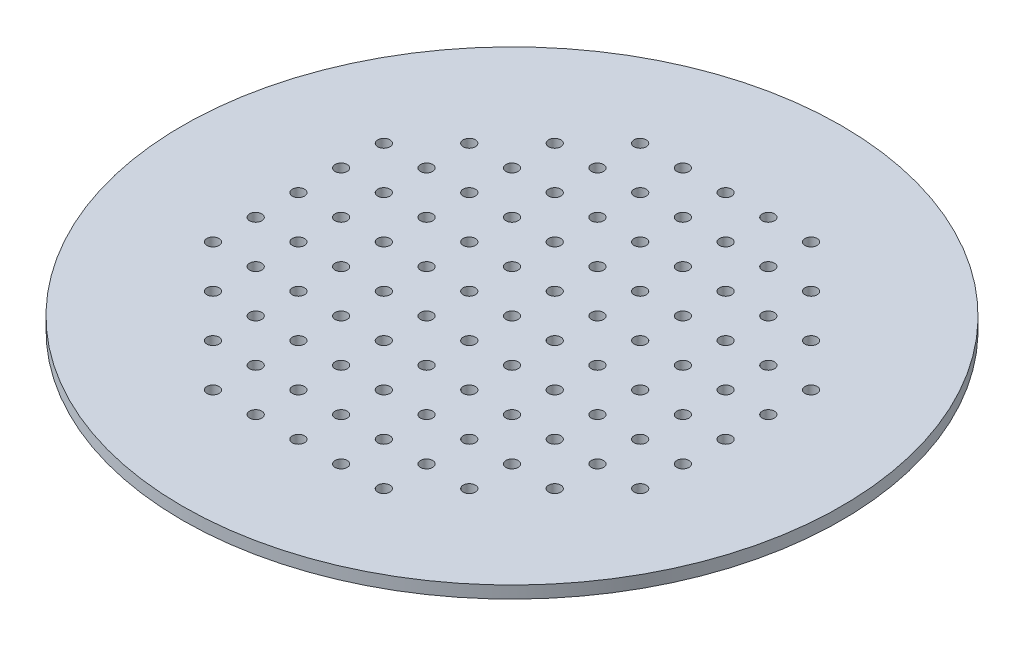
from build123d import *

# Parameters (mm, degrees)
SKETCH_1_R               = 2700
EXTRUDE_1_DEPTH          = 100
SKETCH_3_R               = 50
CUT_EXTRUDE_1_DEPTH      = 3820.685850957
PATTERN_CIRCULAR_1_COUNT = 4


with BuildPart() as part:
    # ｽｹｯﾁ1 → ﾎﾞｽ - 押し出し1 (new body)
    with BuildSketch(Plane(origin=(0, 0, 0), x_dir=(1, 0, 0), z_dir=(0, 1, 0))):
        Circle(SKETCH_1_R)
    extrude(amount=EXTRUDE_1_DEPTH)

    # ｽｹｯﾁ3 → ｶｯﾄ - 押し出し1 (cut, through all)
    with BuildSketch(Plane(origin=(0, 100, 0), x_dir=(1, 0, 0), z_dir=(0, 1, 0))):
        Circle(SKETCH_3_R)
        with Locations((350, 0)):
            Circle(SKETCH_3_R)
        with Locations((700, 0)):
            Circle(SKETCH_3_R)
        with Locations((1050, 0)):
            Circle(SKETCH_3_R)
        with Locations((1400, 0)):
            Circle(SKETCH_3_R)
        with Locations((1750, 0)):
            Circle(SKETCH_3_R)
        with Locations((350, 350)):
            Circle(SKETCH_3_R)
        with Locations((700, 350)):
            Circle(SKETCH_3_R)
        with Locations((1050, 350)):
            Circle(SKETCH_3_R)
        with Locations((1400, 350)):
            Circle(SKETCH_3_R)
        with Locations((1750, 350)):
            Circle(SKETCH_3_R)
        with Locations((350, 700)):
            Circle(SKETCH_3_R)
        with Locations((700, 700)):
            Circle(SKETCH_3_R)
        with Locations((1050, 700)):
            Circle(SKETCH_3_R)
        with Locations((1400, 700)):
            Circle(SKETCH_3_R)
        with Locations((1750, 700)):
            Circle(SKETCH_3_R)
        with Locations((350, 1050)):
            Circle(SKETCH_3_R)
        with Locations((700, 1050)):
            Circle(SKETCH_3_R)
        with Locations((1050, 1050)):
            Circle(SKETCH_3_R)
        with Locations((1400, 1050)):
            Circle(SKETCH_3_R)
        with Locations((350, 1400)):
            Circle(SKETCH_3_R)
        with Locations((700, 1400)):
            Circle(SKETCH_3_R)
        with Locations((1050, 1400)):
            Circle(SKETCH_3_R)
        with Locations((350, 1750)):
            Circle(SKETCH_3_R)
        with Locations((700, 1750)):
            Circle(SKETCH_3_R)
        with Locations((0, 350)):
            Circle(SKETCH_3_R)
        with Locations((0, 700)):
            Circle(SKETCH_3_R)
        with Locations((0, 1050)):
            Circle(SKETCH_3_R)
        with Locations((0, 1400)):
            Circle(SKETCH_3_R)
        with Locations((0, 1750)):
            Circle(SKETCH_3_R)
    cut_extrude_1 = extrude(amount=-CUT_EXTRUDE_1_DEPTH, mode=Mode.SUBTRACT)

    # 円形ﾊﾟﾀｰﾝ1: ｶｯﾄ - 押し出し1 ×4 about axis
    pattern_circular_1_axis = Axis((0, 100, 0), (0, -1, 0))
    for i in range(1, PATTERN_CIRCULAR_1_COUNT):
        add(cut_extrude_1.rotate(pattern_circular_1_axis, i * 360 / PATTERN_CIRCULAR_1_COUNT), mode=Mode.SUBTRACT)


solid = part.part
